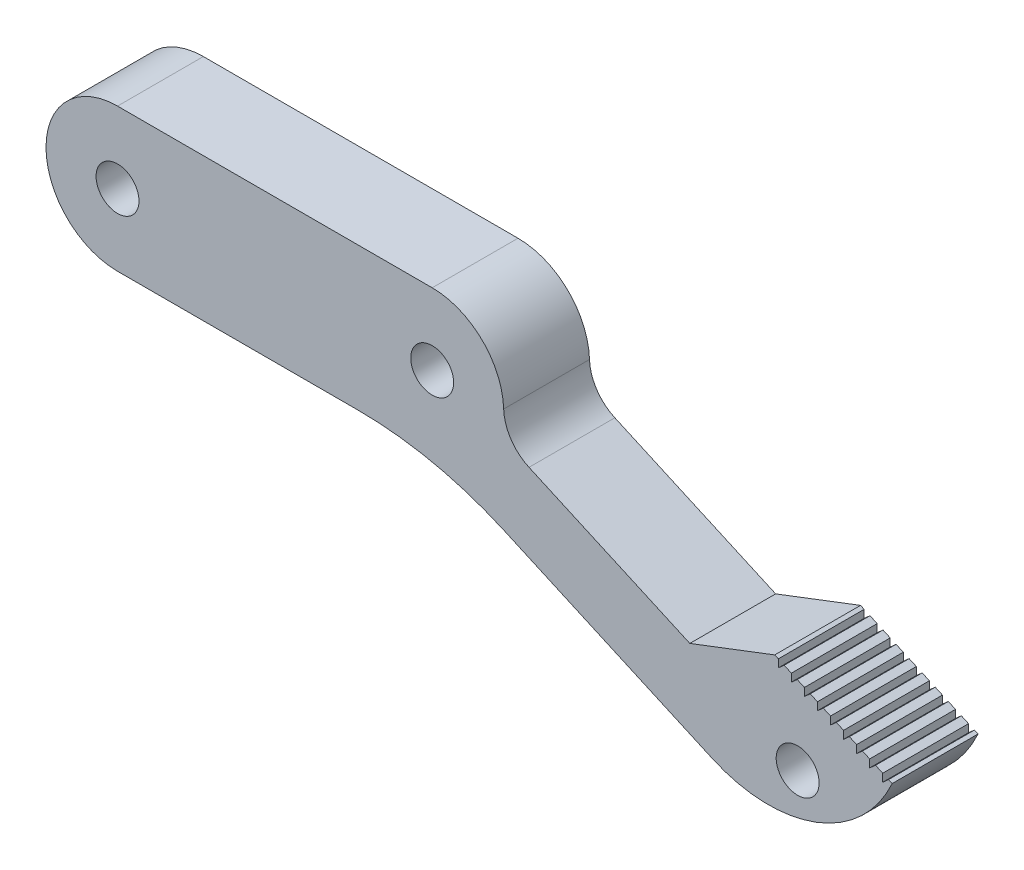
from build123d import *

# Parameters (mm, degrees)
SKETCH_1_R             = 1.5
EXTRUDE_1_DEPTH        = 6
EXTRUDE_START          = -6
SKETCH_2_R             = 1.5
EXTRUDE_2_DEPTH        = 6
CUT_EXTRUDE_1_DEPTH    = 6
PATTERN_LINEAR_1_COUNT = 9
PATTERN_LINEAR_1_PITCH = 1


with BuildPart() as part:
    # 草图1 → 凸台-拉伸1 (new body)
    with BuildSketch(Plane.XY):
        with BuildLine():
            Line((-11, 5), (11, 5))
            ThreePointArc((11, 5), (16, 0), (11, -5))
            Line((11, -5), (-11, -5))
            ThreePointArc((-11, -5), (-16, 0), (-11, 5))
        make_face()
        with Locations((-11, 0)):
            Circle(SKETCH_1_R, mode=Mode.SUBTRACT)
        with Locations((11, 0)):
            Circle(SKETCH_1_R, mode=Mode.SUBTRACT)
    extrude(amount=EXTRUDE_1_DEPTH)

    # 草图2 → 凸台-拉伸2 (add)
    with BuildSketch(Plane.XY.offset(6).offset(EXTRUDE_START)):
        with BuildLine():
            Line((17.768794041, -2.486649801), (29.011601927, -7.527047167))
            Line((29.011601927, -7.527047167), (34.945301709, -5.255713659))
            Line((34.945301709, -5.255713659), (43.157744395, -8.937531841))
            ThreePointArc((43.157744395, -8.937531841), (37.870669943, -13.928931417), (30.602691257, -13.719857707))
            Line((30.602691257, -13.719857707), (16.032361282, -7.187659205))
            ThreePointArc((16.032361282, -7.187659205), (11.034404004, -5.553031682), (5.805088555, -5))
            Line((5.805088555, -5), (11, -5))
            ThreePointArc((11, -5), (14.590532493, -3.479666135), (15.99754173, 0.156769434))
            ThreePointArc((15.99754173, 0.156769434), (16.503827213, -1.419121599), (17.768794041, -2.486649801))
        make_face()
        with Locations((36.549821691, -11.454545455)):
            Circle(SKETCH_2_R, mode=Mode.SUBTRACT)
    extrude(amount=EXTRUDE_2_DEPTH)

    # 草图3 → 切除-拉伸1 (cut)
    with BuildSketch(Plane.XY.offset(6)):
        Polygon((42.906043034, -8.8246886), (42.496952125, -9.189233202), (42.496952125, -8.641284173), align=None)
    cut_extrude_1 = extrude(amount=-CUT_EXTRUDE_1_DEPTH, mode=Mode.SUBTRACT)

    # 阵列(线性)1: 切除-拉伸1 ×9
    with Locations(*[Vector(-0.9124936318129422, 0.4090909090909094, 0) * (i * PATTERN_LINEAR_1_PITCH) for i in range(1, PATTERN_LINEAR_1_COUNT)]):
        add(cut_extrude_1, mode=Mode.SUBTRACT)


solid = part.part
